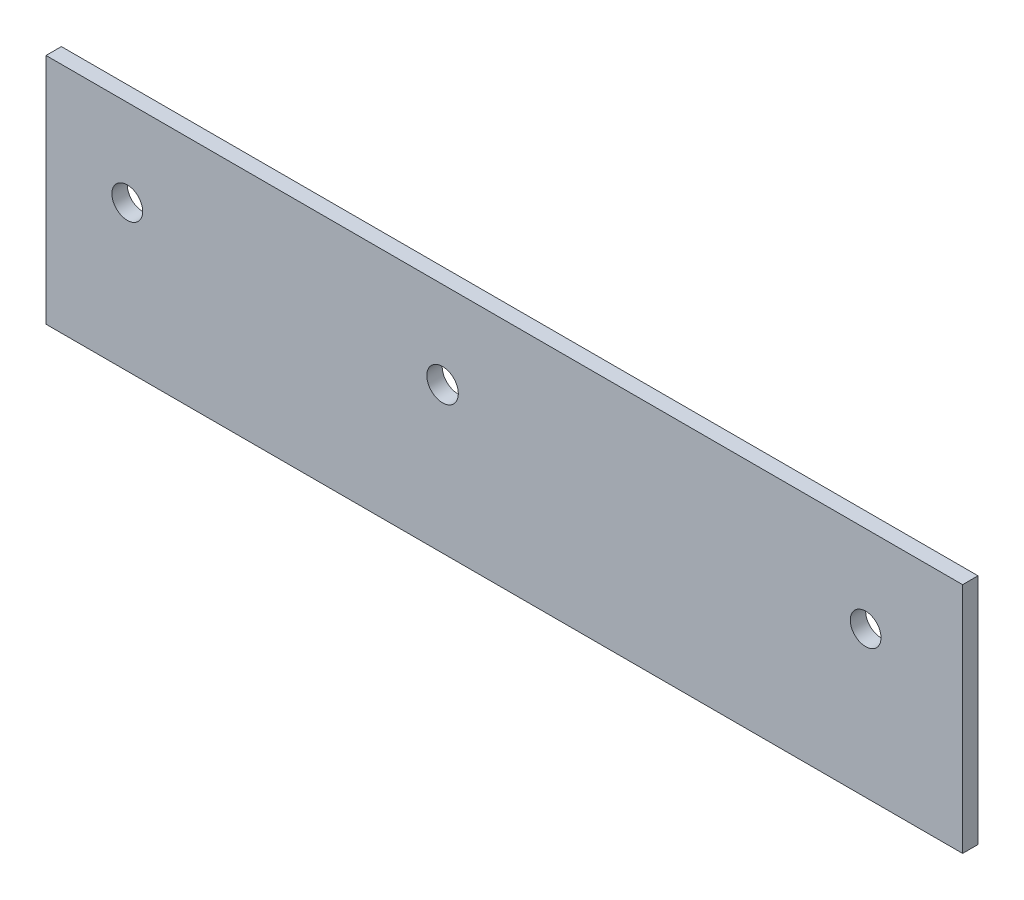
from build123d import *

# Parameters (mm, degrees)
SKETCH1_W           = 189.193979042
SKETCH1_H           = 48.048216354
SKETCH1_R           = 3.175
SKETCH1_R_2         = 3.2512
BOSS_EXTRUDE1_DEPTH = 3.175


with BuildPart() as part:
    # Sketch1 → Boss-Extrude1 (new body)
    with BuildSketch(Plane.XY):
        with Locations((154.020219565, -6.106288288)):
            Rectangle(SKETCH1_W, SKETCH1_H)
        with Locations((76.2, 0)):
            Circle(SKETCH1_R, mode=Mode.SUBTRACT)
        with Locations((228.6, 0)):
            Circle(SKETCH1_R, mode=Mode.SUBTRACT)
        with Locations((141.2748, 0)):
            Circle(SKETCH1_R_2, mode=Mode.SUBTRACT)
    extrude(amount=BOSS_EXTRUDE1_DEPTH)


solid = part.part
